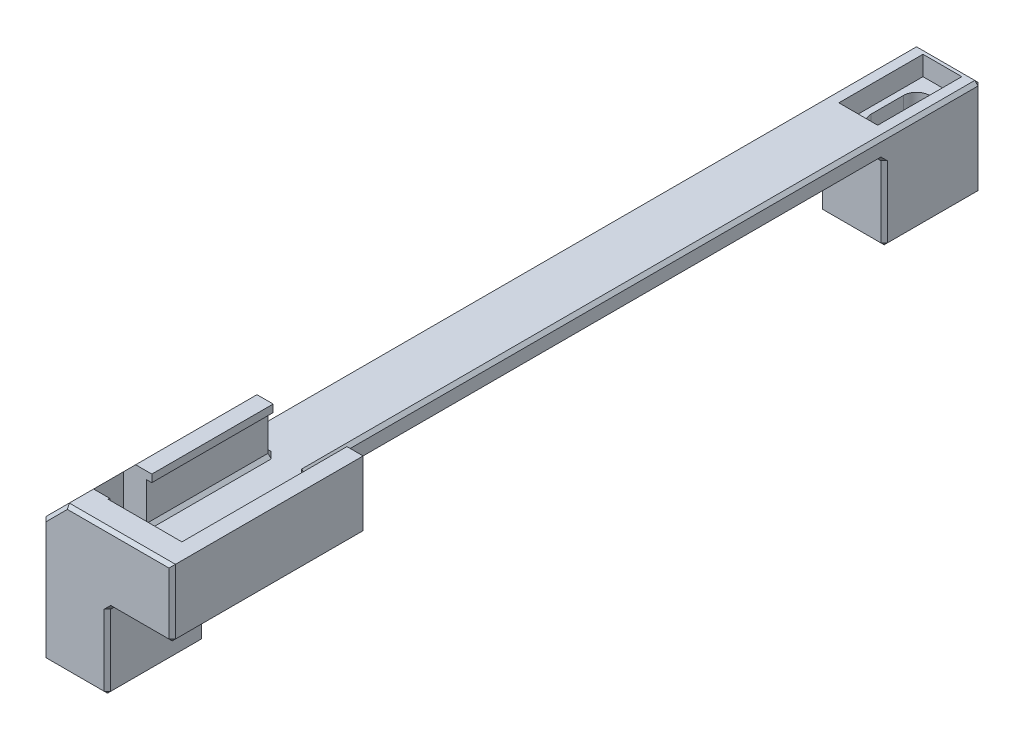
from build123d import *

# Parameters (mm, degrees)
SKETCH2_W             = 10
SKETCH2_H             = 15
BOSS_EXTRUDE1_DEPTH   = 12
BOSS_EXTRUDE1_2_DEPTH = 12
BOSS_EXTRUDE2_DEPTH   = 30
CUT_EXTRUDE3_START    = -0.8
SKETCH5_W             = 26
SKETCH5_H             = 6.35
CUT_EXTRUDE3_DEPTH    = 13
SKETCH9_W             = 6.5
SKETCH9_H             = 6.5
CUT_EXTRUDE7_DEPTH    = 129.938939037
SKETCH11_W            = 11.4
SKETCH11_H            = 7.5
BOSS_EXTRUDE3_DEPTH   = 4
SKETCH12_W            = 10
SKETCH12_H            = 3
BOSS_EXTRUDE4_DEPTH   = 105
SKETCH13_W            = 6
SKETCH13_H            = 13
CUT_EXTRUDE9_DEPTH    = 129.938939037
SKETCH16_W            = 0.4
SKETCH16_H            = 6.35
BOSS_EXTRUDE5_DEPTH   = 0.15
CHAMFER3_SIZE         = 0.5


with BuildPart() as part:
    # Sketch2 → Boss-Extrude1 (new body)
    with BuildSketch(Plane(origin=(0, 0, 0), x_dir=(1, 0, 0), z_dir=(0, 1, 0))):
        Rectangle(SKETCH2_W, SKETCH2_H)
        Polygon((-1.75, -1.010362971), (0, -2.020725942), (1.75, -1.010362971), (1.75, 1.010362971), (0, 2.020725942), (-1.75, 1.010362971), align=None, mode=Mode.SUBTRACT)
    extrude(amount=BOSS_EXTRUDE1_DEPTH)


with BuildPart() as body_2:
    # Sketch2 → Boss-Extrude1 2 (new body)
    with BuildSketch(Plane(origin=(0, 0, 0), x_dir=(1, 0, 0), z_dir=(0, 1, 0))):
        with Locations((0, 120)):
            Rectangle(SKETCH2_W, SKETCH2_H)
        with BuildLine():
            Line((-2, 117.5), (-2, 122.5))
            ThreePointArc((-2, 122.5), (0, 124.5), (2, 122.5))
            Line((2, 122.5), (2, 117.5))
            ThreePointArc((2, 117.5), (0, 115.5), (-2, 117.5))
        make_face(mode=Mode.SUBTRACT)
    extrude(amount=BOSS_EXTRUDE1_2_DEPTH)



with BuildPart() as body_3:
    # Sketch3 → Boss-Extrude2 (new body)
    with BuildSketch(Plane.XY.offset(7.5)):
        Polygon((-1.4, 22.5), (1.1, 22.5), (1.1, 15), (12.5, 15), (12.5, 22.5), (15, 22.5), (15, 12), (-5, 12), (-5, 18.9), align=None)
    extrude(amount=-BOSS_EXTRUDE2_DEPTH)

    # Sketch5 → Cut-Extrude3 (cut)
    with BuildSketch(Plane.ZY.offset(-12.5).offset(CUT_EXTRUDE3_START)):
        with Locations((-9.5, 18.175)):
            Rectangle(SKETCH5_W, SKETCH5_H)
    extrude(amount=CUT_EXTRUDE3_DEPTH, mode=Mode.SUBTRACT)

    # Sketch9 → Cut-Extrude7 (cut, through all)
    with BuildSketch(Plane(origin=(0, 12, 0), x_dir=(1, 0, 0), z_dir=(0, 1, 0))):
        Rectangle(SKETCH9_W, SKETCH9_H)
    extrude(amount=CUT_EXTRUDE7_DEPTH, mode=Mode.SUBTRACT)

    # Sketch11 → Boss-Extrude3 (add)
    with BuildSketch(Plane.XY.offset(7.5)):
        with Locations((6.8, 18.75)):
            Rectangle(SKETCH11_W, SKETCH11_H)
    extrude(amount=-BOSS_EXTRUDE3_DEPTH)


with BuildPart() as body_2_1:
    add(body_2.part)

    add(body_3.part)  # Boss-Extrude4 merges body 3
    # Sketch12 → Boss-Extrude4 (add)
    with BuildSketch(Plane(origin=(0, 0, -22.5), x_dir=(-1, 0, 0), z_dir=(0, 0, -1))):
        with Locations((0, 13.5)):
            Rectangle(SKETCH12_W, SKETCH12_H)
    extrude(amount=BOSS_EXTRUDE4_DEPTH)

    # Sketch13 → Cut-Extrude9 (cut, through all)
    with BuildSketch(Plane.XZ.offset(-12)):
        with Locations((0, -120)):
            Rectangle(SKETCH13_W, SKETCH13_H)
    extrude(amount=-CUT_EXTRUDE9_DEPTH, mode=Mode.SUBTRACT)

    # Combine2: union part
    add(part.part)

    # Sketch16 → Boss-Extrude5 (add)
    with BuildSketch(Plane.ZY.offset(-13.3)):
        with Locations((-17.3, 18.175)):
            Rectangle(SKETCH16_W, SKETCH16_H)
        with Locations((-12.3, 18.175)):
            Rectangle(SKETCH16_W, SKETCH16_H)
        with Locations((-7.3, 18.175)):
            Rectangle(SKETCH16_W, SKETCH16_H)
        with Locations((-2.3, 18.175)):
            Rectangle(SKETCH16_W, SKETCH16_H)
    extrude(amount=BOSS_EXTRUDE5_DEPTH)

    # Chamfer3
    chamfer3_edges = [body_2_1.edges().sort_by_distance(p)[0] for p in [
        (10, 12, -22.5),
        (5, 7.5, -127.5),
        (5, 15, -75),
        (5, 13.5, -22.5),
        (0, 15, -127.5),
        (-5, 15, -75),
        (-2.35, 15, -22.5),
        (-5, 7.5, -127.5),
        (-5, 12, -60),
        (5, 12, -67.5),
        (0, 12, -112.5),
        (-2, 0, -120),
        (0, 0, -115.5),
        (2, 0, -120),
        (0, 0, -124.5),
        (5, 0, -120),
        (5, 6, -112.5),
        (0, 0, -127.5),
        (-5, 0, -120),
        (0, 0, -112.5),
        (-5, 6, -112.5),
        (15, 17.25, 7.5),
        (-5, 9.45, 7.5),
        (15, 17.25, -22.5),
        (10, 12, 7.5),
        (5, 12, 0),
        (0, 12, -7.5),
        (-0.875, 0, -1.515544457),
        (-1.75, 0, 0),
        (-0.875, 0, 1.515544457),
        (0.875, 0, 1.515544457),
        (1.75, 0, 0),
        (0.875, 0, -1.515544457),
        (5, 0, 0),
        (5, 6, 7.5),
        (0, 0, -7.5),
        (5, 6, -7.5),
        (-5, 0, 0),
        (-5, 6, -7.5),
        (0, 0, 7.5),
        (15, 12, -7.5),
        (13.75, 22.5, -22.5),
        (12.5, 21.925, -22.5),
        (9.15, 15, -22.5),
        (1.1, 21.925, -22.5),
        (12.9, 21.35, -22.5),
        (-0.15, 22.5, -22.5),
        (0.7, 21.35, -22.5),
        (0.3, 18.175, -22.5),
        (13.3, 18.175, -22.5),
        (-3.2, 20.7, -22.5),
        (-5, 16.95, -22.5),
        (0.3, 15, -12.875),
        (-3.2, 20.7, 7.5),
        (6.8, 22.5, 7.5),
    ]]
    chamfer(chamfer3_edges, length=CHAMFER3_SIZE)


solid = body_2_1.part
